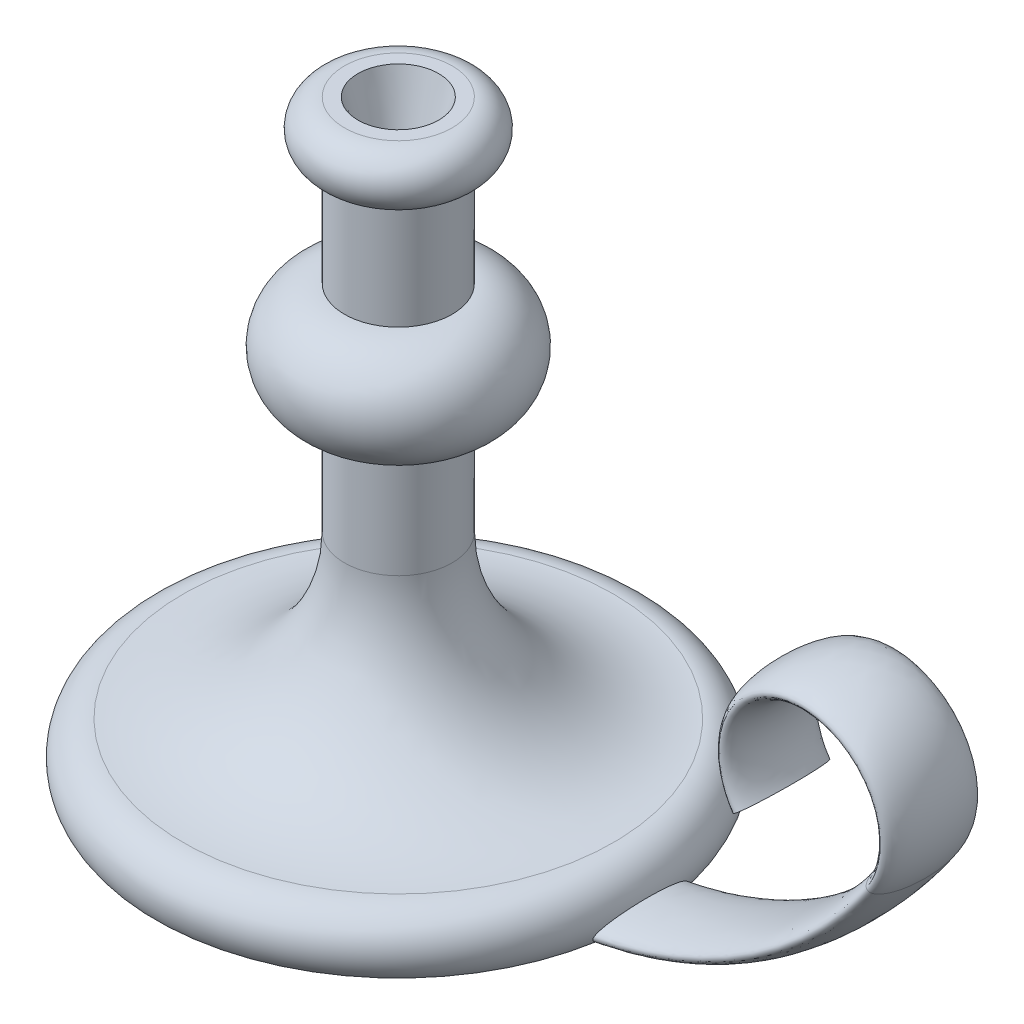
from build123d import *

# Parameters (mm, degrees)
SKETCH3_RX         = 17.5
SKETCH3_RY         = 5
SKETCH4_R          = 15
CUT_EXTRUDE1_DEPTH = 25
CUT_EXTRUDE1_DRAFT = -15


with BuildPart() as part:
    # Sketch1 → Revolve1 (revolve)
    with BuildSketch(Plane.XY, mode=Mode.PRIVATE) as revolve1_sk:
        with BuildLine():
            Line((0, 0), (0, 220))
            Line((0, 220), (20, 220))
            ThreePointArc((20, 220), (30, 210), (20, 200))
            Line((20, 200), (20, 160))
            ThreePointArc((20, 160), (40, 140), (20, 120))
            Line((20, 120), (20, 80))
            ThreePointArc((20, 80), (37.573593129, 37.573593129), (80, 20))
            ThreePointArc((80, 20), (91.180339887, 13.090169944), (90, 0))
            Line((90, 0), (0, 0))
        make_face()
    revolve(revolve1_sk.sketch.rotate(Axis((0, 0, 0), (0, 1, 0)), 90), axis=Axis((0, 0, 0), (0, 1, 0)))

    # Sweep1: sweep along a path in Sketch2
    with BuildLine(Plane.XY) as sweep1_path:
        Line((0, 10), (60, 10))
        ThreePointArc((60, 10), (129.821200219, 27.240819526), (183.592070943, 75))
        ThreePointArc((183.592070943, 75), (167.113128151, 106.333333333), (150.634185358, 75))
    # Sketch3 → Sweep1 (sweep)
    with BuildSketch(Plane(origin=(0, 0, 0), x_dir=(0, 0, -1), z_dir=(1, 0, 0))):
        with Locations(Location((0, 0), (0, 0, 180))):
            Ellipse(SKETCH3_RX, SKETCH3_RY)
    sweep(path=sweep1_path.line)


with BuildPart() as cut_extrude1_tool:
    # Sketch4 → Cut-Extrude1 (with draft: the straight prism first)
    with BuildSketch(Plane(origin=(0, 220, 0), x_dir=(1, 0, 0), z_dir=(0, 1, 0))):
        Circle(SKETCH4_R)
    extrude(amount=-CUT_EXTRUDE1_DEPTH)
    # Cut-Extrude1: the draft: its side faces are tilted about the plane it starts from
    cut_extrude1_sides = [cut_extrude1_tool.faces().sort_by_distance(p)[0] for p in [
        (-15, 207.5, 0),
    ]]
    draft(cut_extrude1_sides, Plane(origin=(0, 220, 0), x_dir=(1, 0, 0), z_dir=(0, 1, 0)), CUT_EXTRUDE1_DRAFT)


with BuildPart() as part_1:
    add(part.part)

    # Cut-Extrude1: cut by cut_extrude1_tool
    add(cut_extrude1_tool.part, mode=Mode.SUBTRACT)


solid = part_1.part
